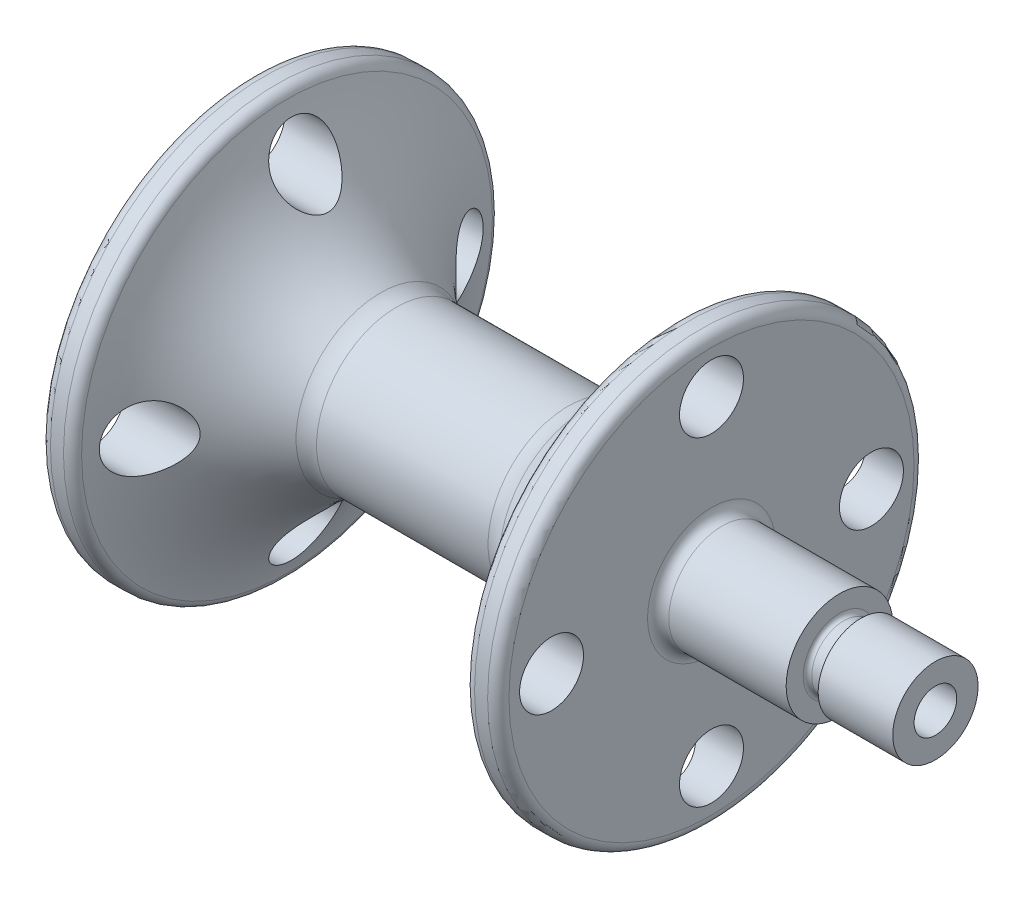
from build123d import *

# Parameters (mm, degrees)
FILLET1_R         = 3
FILLET2_R         = 0.4
FILLET3_R         = 1
FILLET4_R         = 1
FILLET5_R         = 1
HOLE1_D           = 6
CIRPATTERN1_COUNT = 4
HOLE2_D           = 4


with BuildPart() as part:
    # Sketch1 → Revolve1 (revolve)
    with BuildSketch(Plane.XY, mode=Mode.PRIVATE) as revolve1_sk:
        Polygon((-36, 5), (-28, 5), (-28, 20), (-25, 20), (-25, 7.5), (12, 7.5), (12, 20), (15, 20), (15, 5), (27, 5), (27, 3), (29, 3), (29, 4), (36, 4), (36, 0), (-36, 0), align=None)
    revolve(revolve1_sk.sketch.rotate(Axis((-36, 0, 0), (1, 0, 0)), 90), axis=Axis((-36, 0, 0), (1, 0, 0)))

    # Sketch2 → Revolve2 (revolve)
    with BuildSketch(Plane.XY, mode=Mode.PRIVATE) as revolve2_sk:
        with BuildLine():
            Line((12, 20), (12, 7.5))
            Line((12, 7.5), (2.317415978, 7.5))
            ThreePointArc((2.317415978, 7.5), (8.520745785, 12.694956368), (12, 20))
        make_face()
        with BuildLine():
            Line((-25, 7.5), (-25, 20))
            ThreePointArc((-25, 20), (-21.520745785, 12.694956368), (-15.317415978, 7.5))
            Line((-15.317415978, 7.5), (-25, 7.5))
        make_face()
    revolve(revolve2_sk.sketch.rotate(Axis((0, 0, 0), (-1, 0, 0)), 90), axis=Axis((0, 0, 0), (-1, 0, 0)))

    # Fillet1
    fillet1_edges = [part.edges().sort_by_distance(p)[0] for p in [
        (-15.317415978, -7.5, 0),
        (2.317415978, -7.5, 0),
    ]]
    fillet(fillet1_edges, radius=FILLET1_R)

    # Fillet2
    fillet2_edges = [part.edges().sort_by_distance(p)[0] for p in [
        (27, 0, -3),
        (29, 0, -3),
    ]]
    fillet(fillet2_edges, radius=FILLET2_R)

    # Fillet3
    fillet3_edges = [part.edges().sort_by_distance(p)[0] for p in [
        (-28, 0, -5),
    ]]
    fillet(fillet3_edges, radius=FILLET3_R)

    # Fillet4
    fillet4_edges = [part.edges().sort_by_distance(p)[0] for p in [
        (15, 0, -5),
    ]]
    fillet(fillet4_edges, radius=FILLET4_R)

    # Fillet5
    fillet5_edges = [part.edges().sort_by_distance(p)[0] for p in [
        (-28, 0, -20),
        (12, 20, 0),
        (15, 0, -20),
        (-25, -20, 0),
    ]]
    fillet(fillet5_edges, radius=FILLET5_R)

    # Hole1 (through all)
    with Locations(Plane.ZY.offset(28)):
        with Locations((15, 0)):
            hole1 = Hole(HOLE1_D / 2)

    # CirPattern1: Hole1 ×4 about axis
    cirpattern1_axis = Axis((0, 0, 0), (1, 0, 0))
    for i in range(1, CIRPATTERN1_COUNT):
        add(hole1.rotate(cirpattern1_axis, i * 360 / CIRPATTERN1_COUNT), mode=Mode.SUBTRACT)

    # Hole2 (through all)
    with Locations(Plane.ZY.offset(36)):
        with Locations((0, 0)):
            Hole(HOLE2_D / 2)


solid = part.part
